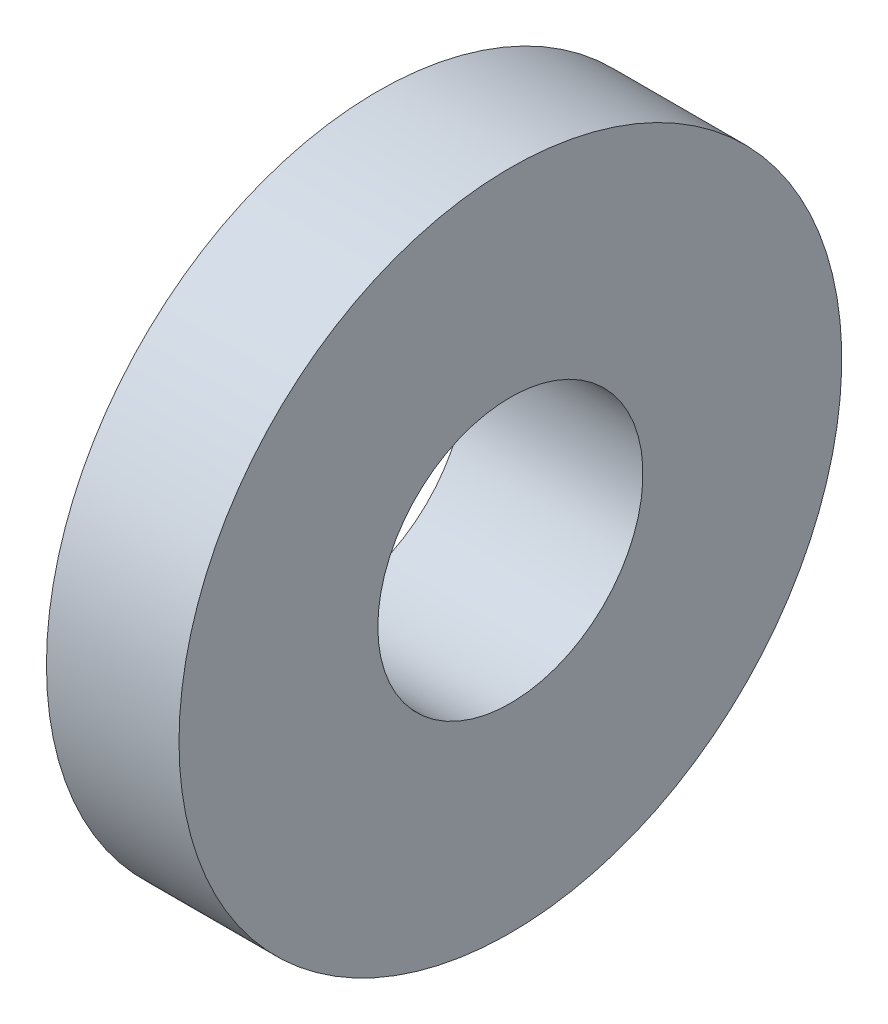
from build123d import *


with BuildPart() as part:
    # Sketch1 → Revolve1 (revolve)
    with BuildSketch(Plane.XY, mode=Mode.PRIVATE) as revolve1_sk:
        Polygon((0, 2.5), (0.5, 2.5), (0.5, 3.75), (2, 3.75), (2, 1.5), (0, 1.5), align=None)
    revolve(revolve1_sk.sketch.rotate(Axis((0, 0, 0), (1, 0, 0)), 90), axis=Axis((0, 0, 0), (1, 0, 0)))


solid = part.part
